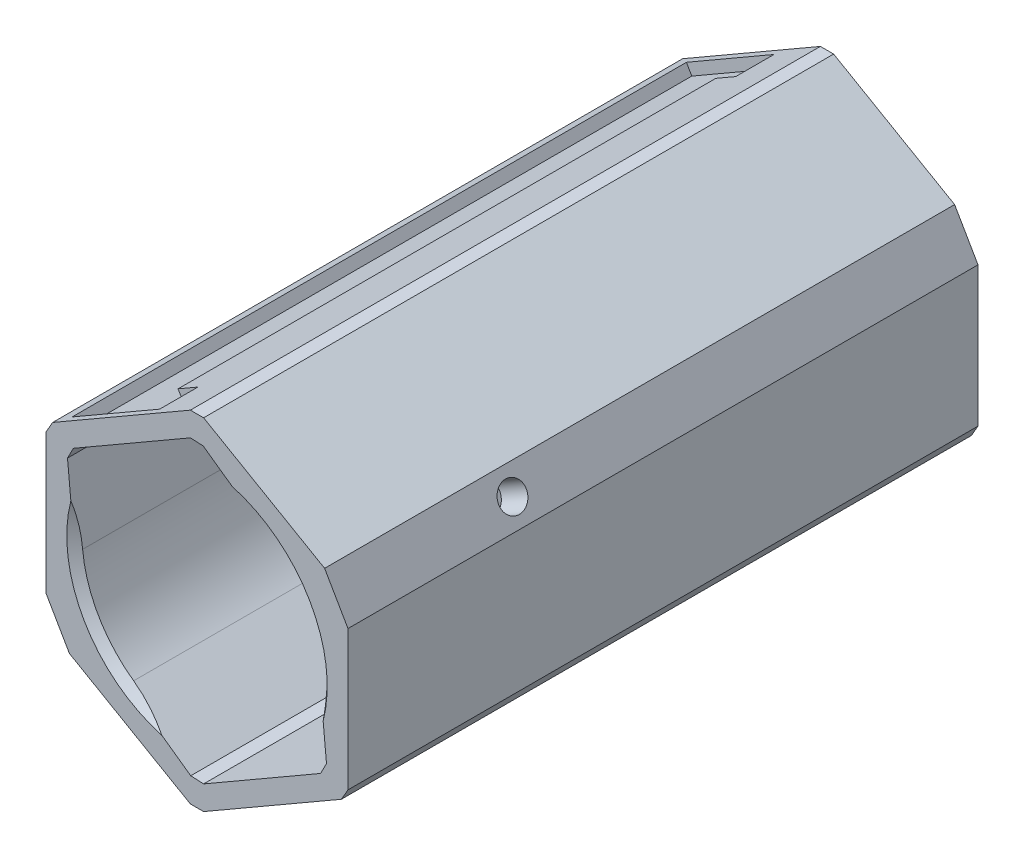
from build123d import *

# Parameters (mm, degrees)
SKETCH2_R               = 16
BOSS_EXTRUDE1_DEPTH     = 82.25
CUT_EXTRUDE1_DEPTH      = 97.457244414
CUT_EXTRUDE1_DEPTH_BACK = 97.457244414
SKETCH3_W               = 152.01959988
SKETCH3_H               = 124.433031562
CUT_EXTRUDE2_DEPTH      = 1.4
CHAMFER2_SIZE           = 1
CHAMFER3_SIZE           = 1
CUT_EXTRUDE3_DEPTH      = 71
CHAMFER4_SIZE           = 1
CUT_EXTRUDE4_DEPTH      = 1.2
SKETCH8_R               = 2.75
CUT_EXTRUDE5_DEPTH      = 87.332400234
CUT_EXTRUDE7_DEPTH      = 5
CHAMFER5_SIZE           = 0.5
CUT_EXTRUDE8_DEPTH      = 88.459952722
SKETCH12_R              = 1.8
CUT_EXTRUDE9_DEPTH      = 4
CUT_EXTRUDE10_START     = -4
SKETCH13_R              = 1.8
CUT_EXTRUDE10_DEPTH     = 4


with BuildPart() as part:
    # Sketch1 → Revolve1 (revolve)
    with BuildSketch(Plane(origin=(0, 0, 0), x_dir=(1, 0, 0), z_dir=(0, 1, 0))):
        Polygon((0, 0), (16.125, 0), (16.125, -71), (19.65, -71), (19.65, 68), (24.95, 68), (24.95, 73), (28.1, 73), (28.1, 68), (42, 68), (42, 76), (16.65, 76), (16.65, 18.004366875), (12.193967069, 18.004366875), (12.193967069, 24.882682167), (0, 24.882682167), align=None)
    revolve(axis=Axis((0, 0, 39.840023079), (0, 0, -1)))

    # Sketch2 → Boss-Extrude1 (add)
    with BuildSketch(Plane.XY.offset(71)):
        Polygon((0, 22.762034363), (-19.7125, 11.381017181), (-19.7125, -11.381017181), (0, -22.762034363), (19.7125, -11.381017181), (19.7125, 11.381017181), align=None)
        Circle(SKETCH2_R, mode=Mode.SUBTRACT)
    extrude(amount=-BOSS_EXTRUDE1_DEPTH)

    # Sketch3 → Cut-Extrude1 (cut, two sides: drawn at the far end of the back side and taken through both)
    with BuildSketch(Plane(origin=(0, 0, 0), x_dir=(1, 0, 0), z_dir=(0, 1, 0)).offset(-CUT_EXTRUDE1_DEPTH_BACK)):
        with Locations((6.162956752, 73.466515781)):
            Rectangle(SKETCH3_W, SKETCH3_H)
    extrude(amount=CUT_EXTRUDE1_DEPTH + CUT_EXTRUDE1_DEPTH_BACK, mode=Mode.SUBTRACT)

    # Sketch4 → Cut-Extrude2 (cut)
    with BuildSketch(Plane(origin=(-9.85625, 17.071525772, 0), x_dir=(0.8660254037844386, 0.5000000000000003, 0), z_dir=(-0.5000000000000002, 0.8660254037844385, 0))):
        Polygon((-8.6, 10.2), (4.6, 10.2), (4.6, 5.2), (1.6, 5.2), (1.6, -65), (4.6, -65), (4.6, -70), (-8.6, -70), align=None)
    extrude(amount=-CUT_EXTRUDE2_DEPTH, mode=Mode.SUBTRACT)

    # Chamfer2
    chamfer2_edges = [part.edges().sort_by_distance(p)[0] for p in [
        (0, 22.762034363, 29.875),
        (19.7125, 11.381017181, 29.875),
        (19.7125, -11.381017181, 29.875),
        (0, -22.762034363, 29.875),
        (-19.7125, -11.381017181, 29.875),
        (-19.7125, 11.381017181, 29.875),
    ]]
    chamfer(chamfer2_edges, length=CHAMFER2_SIZE)

    # Chamfer3
    chamfer3_edges = [part.edges().sort_by_distance(p)[0] for p in [
        (-16, 0, 71),
    ]]
    chamfer(chamfer3_edges, length=CHAMFER3_SIZE)

    # Sketch5 → Cut-Extrude3 (cut)
    with BuildSketch(Plane.XY.offset(71)):
        with BuildLine():
            Line((-17, 9.814954576), (-15.92887426, -1.50697207))
            ThreePointArc((-15.92887426, -1.50697207), (-8, 13.85640646), (9.269513225, 13.041323728))
            Line((9.269513225, 13.041323728), (0, 19.629909152))
            Line((0, 19.629909152), (-17, 9.814954576))
        make_face()
        with BuildLine():
            Line((0, -19.629909152), (17, -9.814954576))
            Line((17, -9.814954576), (15.92887426, 1.50697207))
            ThreePointArc((15.92887426, 1.50697207), (8, -13.856406461), (-9.269513225, -13.041323728))
            Line((-9.269513225, -13.041323728), (0, -19.629909152))
        make_face()
    extrude(amount=-CUT_EXTRUDE3_DEPTH, mode=Mode.SUBTRACT)

    # Chamfer4
    chamfer4_edges = [part.edges().sort_by_distance(p)[0] for p in [
        (0, -19.629909152, 35.5),
        (17, -9.814954576, 35.5),
        (0, 19.629909152, 35.5),
        (-17, 9.814954576, 35.5),
    ]]
    chamfer(chamfer4_edges, length=CHAMFER4_SIZE)

    # Sketch6 → Cut-Extrude4 (cut)
    with BuildSketch(Plane(origin=(0, 0, -11.25), x_dir=(-1, 0, 0), z_dir=(0, 0, -1))):
        Polygon((-7.216878365, 12.5), (-14.43375673, 0), (-7.216878365, -12.5), (7.216878365, -12.5), (14.43375673, 0), (7.216878365, 12.5), align=None)
    extrude(amount=-CUT_EXTRUDE4_DEPTH, mode=Mode.SUBTRACT)

    # Sketch8 → Cut-Extrude5 (cut, through all)
    with BuildSketch(Plane(origin=(0, 0, -10.05), x_dir=(-1, 0, 0), z_dir=(0, 0, -1))):
        Circle(SKETCH8_R)
    extrude(amount=-CUT_EXTRUDE5_DEPTH, mode=Mode.SUBTRACT)

    # Sketch10 → Cut-Extrude7 (cut)
    with BuildSketch(Plane.XY):
        with BuildLine():
            Line((2.5, 10), (-2.5, 10))
            Line((-2.5, 10), (-2.5, 7.071067812))
            ThreePointArc((-2.5, 7.071067812), (0, -7.5), (2.5, 7.071067812))
            Line((2.5, 7.071067812), (2.5, 10))
        make_face()
    extrude(amount=-CUT_EXTRUDE7_DEPTH, mode=Mode.SUBTRACT)

    # Chamfer5
    chamfer5_edges = [part.edges().sort_by_distance(p)[0] for p in [
        (0, -7.5, 0),
        (2.5, 8.535533906, 0),
        (0, 10, 0),
        (-2.5, 8.535533906, 0),
    ]]
    chamfer(chamfer5_edges, length=CHAMFER5_SIZE)

    # Sketch11 → Cut-Extrude8 (cut, through all)
    with BuildSketch(Plane.XY.offset(71)):
        Polygon((19.7125, 11.381017181), (16.660566959, 13.143051544), (19.7125, 7.856948456), align=None)
        Polygon((-16.660566959, -13.143051544), (-19.7125, -11.381017181), (-19.7125, -7.856948456), align=None)
    extrude(amount=-CUT_EXTRUDE8_DEPTH, mode=Mode.SUBTRACT)

    # Sketch12 → Cut-Extrude9 (cut)
    with BuildSketch(Plane(origin=(-18.186533479, -10.5, 0), x_dir=(0, 0, 1), z_dir=(-0.8660254037844382, -0.500000000000001, 0))):
        with Locations(Location((48, 0, 0), (0, 0, 270))):
            Circle(SKETCH12_R)
    extrude(amount=-CUT_EXTRUDE9_DEPTH, mode=Mode.SUBTRACT)

    # Sketch13 → Cut-Extrude10 (cut)
    with BuildSketch(Plane(origin=(18.186533479, 10.5, 0), x_dir=(0, 0, -1), z_dir=(0.8660254037844387, 0.4999999999999999, 0)).offset(CUT_EXTRUDE10_START)):
        with Locations(Location((-48, 0, 0), (0, 0, 270))):
            Circle(SKETCH13_R)
    extrude(amount=CUT_EXTRUDE10_DEPTH, mode=Mode.SUBTRACT)


solid = part.part
